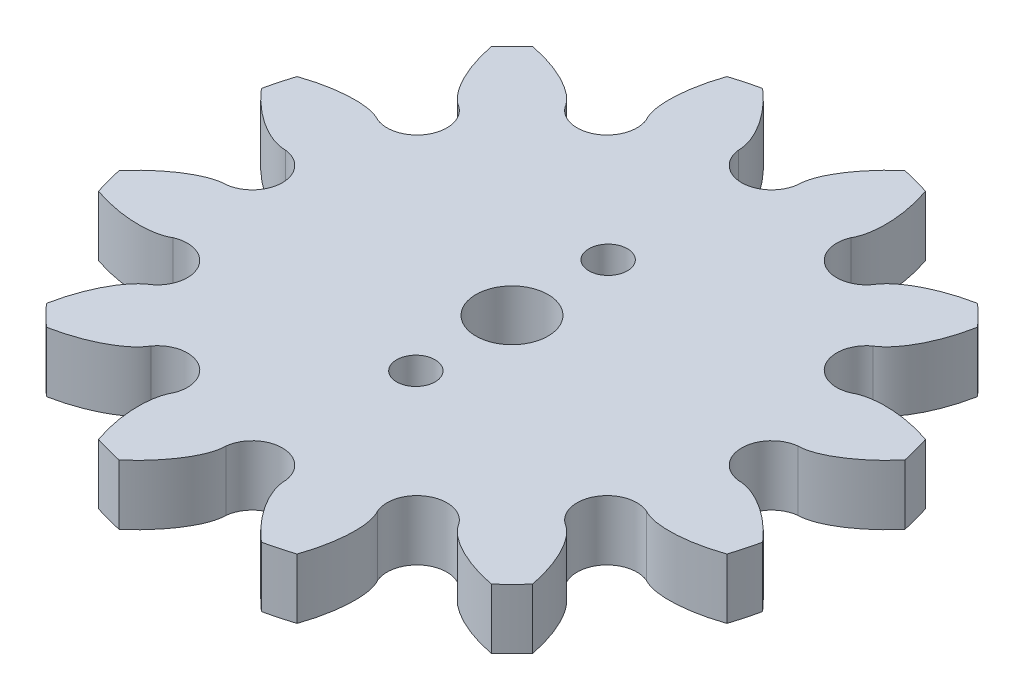
from build123d import *

# Parameters (mm, degrees)
RESSALTO_EXTRUS_O1_DEPTH = 5
ESBO_O3_R                = 3
ESBO_O3_R_2              = 1.6
CORTE_EXTRUS_O1_DEPTH    = 10


with BuildPart() as part:
    # Esboço1 → Ressalto-extrusão1 (new body)
    with BuildSketch(Plane.XZ.offset(5)):
        with BuildLine():
            ThreePointArc((-19.691703555, 75.492649623), (-16.544693651, 74.447916667), (-17.213433323, 71.200159666))
            add(Edge.make_bspline(
                [(-17.213433323, 71.200159666), (-19.371007478, 69.977475346), (-20.225381706, 65.490339119)],
                knots=[3.520301614, 3.520301614, 3.520301614, 4.832179179, 4.832179179, 4.832179179], degree=2, weights=[1, 0.79247571, 1]))
            ThreePointArc((-20.225381706, 65.490339119), (-19.386510918, 64.613489082), (-18.509660881, 63.774618294))
            add(Edge.make_bspline(
                [(-18.509660881, 63.774618294), (-14.022524654, 64.628992522), (-12.799840334, 66.786566677)],
                knots=[4.592598781, 4.592598781, 4.592598781, 5.904476347, 5.904476347, 5.904476347], degree=2, weights=[1, 0.79247571, 1]))
            ThreePointArc((-12.799840334, 66.786566677), (-9.552083333, 67.455306349), (-8.507350377, 64.308296445))
            add(Edge.make_bspline(
                [(-8.507350377, 64.308296445), (-9.764522246, 62.170633685), (-8.260863918, 57.857472608)],
                knots=[0.37870896, 0.37870896, 0.37870896, 1.690586526, 1.690586526, 1.690586526], degree=2, weights=[1, 0.79247571, 1]))
            ThreePointArc((-8.260863918, 57.857472608), (-7.095955487, 57.517533596), (-5.917145685, 57.2294752))
            add(Edge.make_bspline(
                [(-5.917145685, 57.2294752), (-2.458358837, 60.2129531), (-2.478270232, 62.692809289)],
                knots=[4.592598781, 4.592598781, 4.592598781, 5.904476347, 5.904476347, 5.904476347], degree=2, weights=[1, 0.79247571, 1]))
            ThreePointArc((-2.478270232, 62.692809289), (0, 64.895833333), (2.478270232, 62.692809289))
            add(Edge.make_bspline(
                [(2.478270232, 62.692809289), (2.458358837, 60.2129531), (5.917145685, 57.2294752)],
                knots=[3.520301614, 3.520301614, 3.520301614, 4.832179179, 4.832179179, 4.832179179], degree=2, weights=[1, 0.79247571, 1]))
            ThreePointArc((5.917145685, 57.2294752), (7.095955487, 57.517533596), (8.260863918, 57.857472608))
            add(Edge.make_bspline(
                [(8.260863918, 57.857472608), (9.764522246, 62.170633685), (8.507350377, 64.308296445)],
                knots=[4.592598781, 4.592598781, 4.592598781, 5.904476347, 5.904476347, 5.904476347], degree=2, weights=[1, 0.79247571, 1]))
            ThreePointArc((8.507350377, 64.308296445), (9.552083333, 67.455306349), (12.799840334, 66.786566677))
            add(Edge.make_bspline(
                [(12.799840334, 66.786566677), (14.022524654, 64.628992522), (18.509660881, 63.774618294)],
                knots=[3.520301614, 3.520301614, 3.520301614, 4.832179179, 4.832179179, 4.832179179], degree=2, weights=[1, 0.79247571, 1]))
            ThreePointArc((18.509660881, 63.774618294), (19.386510918, 64.613489082), (20.225381706, 65.490339119))
            add(Edge.make_bspline(
                [(20.225381706, 65.490339119), (19.371007478, 69.977475346), (17.213433323, 71.200159666)],
                knots=[4.592598781, 4.592598781, 4.592598781, 5.904476347, 5.904476347, 5.904476347], degree=2, weights=[1, 0.79247571, 1]))
            ThreePointArc((17.213433323, 71.200159666), (16.544693651, 74.447916667), (19.691703555, 75.492649623))
            add(Edge.make_bspline(
                [(19.691703555, 75.492649623), (21.829366315, 74.235477754), (26.142527392, 75.739136082)],
                knots=[3.520301614, 3.520301614, 3.520301614, 4.832179179, 4.832179179, 4.832179179], degree=2, weights=[1, 0.79247571, 1]))
            ThreePointArc((26.142527392, 75.739136082), (26.482466404, 76.904044513), (26.7705248, 78.082854315))
            add(Edge.make_bspline(
                [(26.7705248, 78.082854315), (23.7870469, 81.541641163), (21.307190711, 81.521729768)],
                knots=[4.592598781, 4.592598781, 4.592598781, 5.904476347, 5.904476347, 5.904476347], degree=2, weights=[1, 0.79247571, 1]))
            ThreePointArc((21.307190711, 81.521729768), (19.104166667, 84), (21.307190711, 86.478270232))
            add(Edge.make_bspline(
                [(21.307190711, 86.478270232), (23.7870469, 86.458358837), (26.7705248, 89.917145685)],
                knots=[0.37870896, 0.37870896, 0.37870896, 1.690586526, 1.690586526, 1.690586526], degree=2, weights=[1, 0.79247571, 1]))
            ThreePointArc((26.7705248, 89.917145685), (26.482466404, 91.095955487), (26.142527392, 92.260863918))
            add(Edge.make_bspline(
                [(26.142527392, 92.260863918), (21.829366315, 93.764522246), (19.691703555, 92.507350377)],
                knots=[1.451006128, 1.451006128, 1.451006128, 2.762883693, 2.762883693, 2.762883693], degree=2, weights=[1, 0.79247571, 1]))
            ThreePointArc((19.691703555, 92.507350377), (16.544693651, 93.552083333), (17.213433323, 96.799840334))
            add(Edge.make_bspline(
                [(17.213433323, 96.799840334), (19.371007478, 98.022524654), (20.225381706, 102.509660881)],
                knots=[0.37870896, 0.37870896, 0.37870896, 1.690586526, 1.690586526, 1.690586526], degree=2, weights=[1, 0.79247571, 1]))
            ThreePointArc((20.225381706, 102.509660881), (19.386510918, 103.386510918), (18.509660881, 104.225381706))
            add(Edge.make_bspline(
                [(18.509660881, 104.225381706), (14.022524654, 103.371007478), (12.799840334, 101.213433323)],
                knots=[4.592598781, 4.592598781, 4.592598781, 5.904476347, 5.904476347, 5.904476347], degree=2, weights=[1, 0.79247571, 1]))
            ThreePointArc((12.799840334, 101.213433323), (9.552083333, 100.544693651), (8.507350377, 103.691703555))
            add(Edge.make_bspline(
                [(8.507350377, 103.691703555), (9.764522246, 105.829366315), (8.260863918, 110.142527392)],
                knots=[0.37870896, 0.37870896, 0.37870896, 1.690586526, 1.690586526, 1.690586526], degree=2, weights=[1, 0.79247571, 1]))
            ThreePointArc((8.260863918, 110.142527392), (7.095955487, 110.482466404), (5.917145685, 110.7705248))
            add(Edge.make_bspline(
                [(5.917145685, 110.7705248), (2.458358837, 107.7870469), (2.478270232, 105.307190711)],
                knots=[1.451006128, 1.451006128, 1.451006128, 2.762883693, 2.762883693, 2.762883693], degree=2, weights=[1, 0.79247571, 1]))
            ThreePointArc((2.478270232, 105.307190711), (0, 103.104166667), (-2.478270232, 105.307190711))
            add(Edge.make_bspline(
                [(-2.478270232, 105.307190711), (-2.458358837, 107.7870469), (-5.917145685, 110.7705248)],
                knots=[0.37870896, 0.37870896, 0.37870896, 1.690586526, 1.690586526, 1.690586526], degree=2, weights=[1, 0.79247571, 1]))
            ThreePointArc((-5.917145685, 110.7705248), (-7.095955487, 110.482466404), (-8.260863918, 110.142527392))
            add(Edge.make_bspline(
                [(-8.260863918, 110.142527392), (-9.764522246, 105.829366315), (-8.507350377, 103.691703555)],
                knots=[1.451006128, 1.451006128, 1.451006128, 2.762883693, 2.762883693, 2.762883693], degree=2, weights=[1, 0.79247571, 1]))
            ThreePointArc((-8.507350377, 103.691703555), (-9.552083333, 100.544693651), (-12.799840334, 101.213433323))
            add(Edge.make_bspline(
                [(-12.799840334, 101.213433323), (-14.022524654, 103.371007478), (-18.509660881, 104.225381706)],
                knots=[0.37870896, 0.37870896, 0.37870896, 1.690586526, 1.690586526, 1.690586526], degree=2, weights=[1, 0.79247571, 1]))
            ThreePointArc((-18.509660881, 104.225381706), (-19.386510918, 103.386510918), (-20.225381706, 102.509660881))
            add(Edge.make_bspline(
                [(-20.225381706, 102.509660881), (-19.371007478, 98.022524654), (-17.213433323, 96.799840334)],
                knots=[1.451006128, 1.451006128, 1.451006128, 2.762883693, 2.762883693, 2.762883693], degree=2, weights=[1, 0.79247571, 1]))
            ThreePointArc((-17.213433323, 96.799840334), (-16.544693651, 93.552083333), (-19.691703555, 92.507350377))
            add(Edge.make_bspline(
                [(-19.691703555, 92.507350377), (-21.829366315, 93.764522246), (-26.142527392, 92.260863918)],
                knots=[0.37870896, 0.37870896, 0.37870896, 1.690586526, 1.690586526, 1.690586526], degree=2, weights=[1, 0.79247571, 1]))
            ThreePointArc((-26.142527392, 92.260863918), (-26.482466404, 91.095955487), (-26.7705248, 89.917145685))
            add(Edge.make_bspline(
                [(-26.7705248, 89.917145685), (-23.7870469, 86.458358837), (-21.307190711, 86.478270232)],
                knots=[1.451006128, 1.451006128, 1.451006128, 2.762883693, 2.762883693, 2.762883693], degree=2, weights=[1, 0.79247571, 1]))
            ThreePointArc((-21.307190711, 86.478270232), (-19.104166667, 84), (-21.307190711, 81.521729768))
            add(Edge.make_bspline(
                [(-21.307190711, 81.521729768), (-23.7870469, 81.541641163), (-26.7705248, 78.082854315)],
                knots=[3.520301614, 3.520301614, 3.520301614, 4.832179179, 4.832179179, 4.832179179], degree=2, weights=[1, 0.79247571, 1]))
            ThreePointArc((-26.7705248, 78.082854315), (-26.482466404, 76.904044513), (-26.142527392, 75.739136082))
            add(Edge.make_bspline(
                [(-26.142527392, 75.739136082), (-21.829366315, 74.235477754), (-19.691703555, 75.492649623)],
                knots=[4.592598781, 4.592598781, 4.592598781, 5.904476347, 5.904476347, 5.904476347], degree=2, weights=[1, 0.79247571, 1]))
        make_face()
    extrude(amount=-RESSALTO_EXTRUS_O1_DEPTH)

    # Esboço3 → Corte-extrusão1 (cut)
    with BuildSketch(Plane.XZ.offset(5)):
        with Locations(Location((0, 84, 0), (0, 0, 270))):
            Circle(ESBO_O3_R)
        with Locations(Location((0, 92, 0), (0, 0, 270))):
            Circle(ESBO_O3_R_2)
        with Locations(Location((0, 76, 0), (0, 0, 270))):
            Circle(ESBO_O3_R_2)
    extrude(amount=-CORTE_EXTRUS_O1_DEPTH, mode=Mode.SUBTRACT)


solid = part.part
